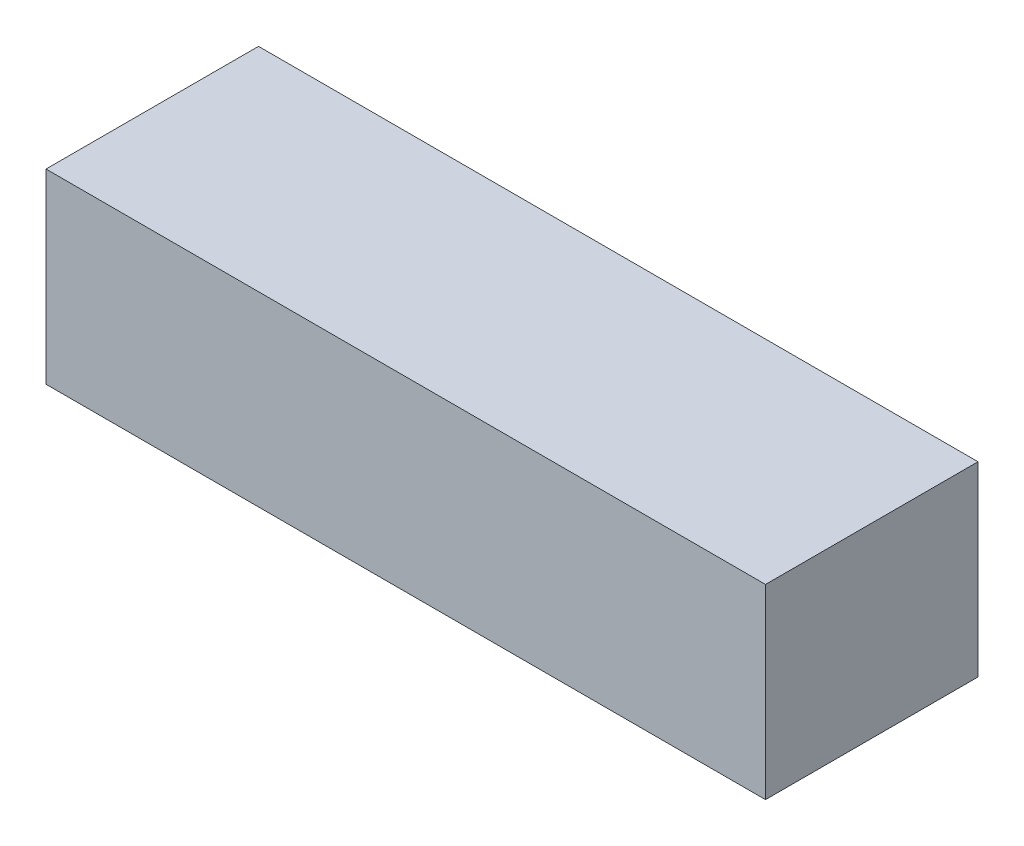
from build123d import *

# Parameters (mm, degrees)
SKETCH1_W           = 14.478
SKETCH1_H           = 12.7
BOSS_EXTRUDE1_DEPTH = 49.022


with BuildPart() as part:
    # Sketch1 → Boss-Extrude1 (new body)
    with BuildSketch(Plane(origin=(0, 0, 0), x_dir=(0, 0, -1), z_dir=(1, 0, 0))):
        Rectangle(SKETCH1_W, SKETCH1_H)
    extrude(amount=BOSS_EXTRUDE1_DEPTH)


solid = part.part
